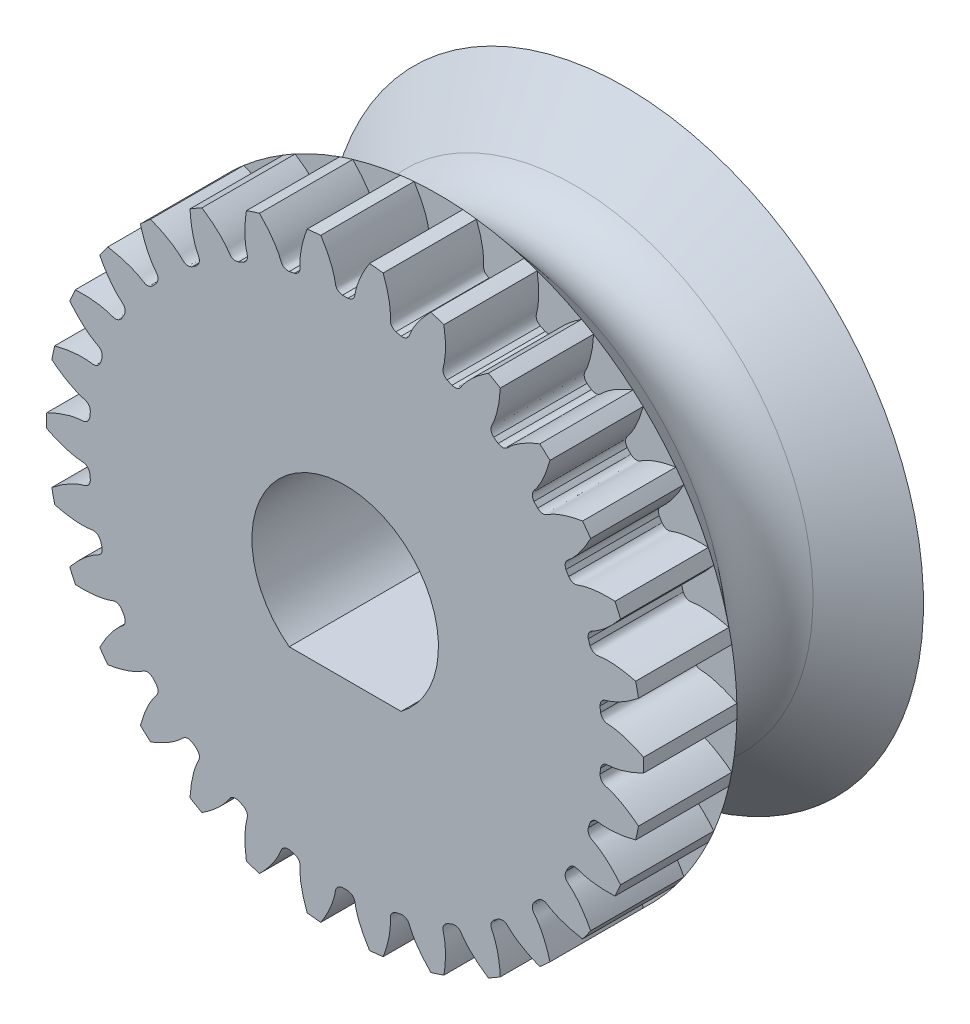
from build123d import *

# Parameters (mm, degrees)
SKETCH_1_R                      = 16
EXTRUDE_1_DEPTH                 = 5
CUT_EXTRUDE_1_DEPTH             = 24.173260453
PATTERN_CIRCULAR_1_COUNT        = 30
FILLET_1_R                      = 3
CUT_EXTRUDE_2_DEPTH             = 28.147746746
SKETCH_6_R                      = 3
CUT_EXTRUDE_3_DEPTH             = 12
CUT_EXTRUDE_4_REACH             = 32.529
SKETCH_7_R                      = 1.6
CUT_EXTRUDE_4_DIRECTION_2_DEPTH = 31.528675209


with BuildPart() as part:
    # 草图1 → 凸台-拉伸1 (new body)
    with BuildSketch(Plane.XY):
        Circle(SKETCH_1_R)
    extrude(amount=EXTRUDE_1_DEPTH)

    # 草图2 → 切除-拉伸1 (cut, through all)
    with BuildSketch(Plane.XY):
        with BuildLine():
            ThreePointArc((0.145558629, 13.749229531), (0, 13.75), (-0.145558629, 13.749229531))
            add(Edge.make_bspline(
                [(-0.145558629, 13.749229531), (-0.50823069, 13.81297517), (-0.510304747, 14.047132636), (-0.55898482, 14.288579015), (-0.569950741, 14.338129238), (-0.583247086, 14.392924909), (-0.599067717, 14.452897992), (-0.617630624, 14.517964907), (-0.639143358, 14.588038514), (-0.663813512, 14.663024477), (-0.691845294, 14.742822461), (-0.723440342, 14.827325855), (-0.758797267, 14.91642195), (-0.798111576, 15.009991983), (-0.841575482, 15.107911227), (-0.889377751, 15.210049075), (-0.941703547, 15.316269128), (-0.99873427, 15.426429286), (-1.060647407, 15.54038185), (-1.127616379, 15.657973616), (-1.199810393, 15.779045984), (-1.277394296, 15.903435064), (-1.36052843, 16.030971789), (-1.449368495, 16.161482028), (-1.544065407, 16.294786707), (-1.644765164, 16.430701934), (-1.751608718, 16.569039116), (-1.864731839, 16.709605098), (-1.984264996, 16.85220229), (-2.110333232, 16.996628804), (-2.243056043, 17.14267859), (-2.382547265, 17.290141584), (-2.528914958, 17.438803847), (-2.682261311, 17.588447714), (-2.842682483, 17.738851945), (-3.068923866, 17.942620828), (-3.245344618, 18.092071531), (-3.366311832, 18.190558123)],
                knots=[0, 0, 0, 0, 0.115323882, 0.12341257, 0.132512303, 0.142623081, 0.153744905, 0.165877774, 0.179021689, 0.193176649, 0.208342655, 0.224519706, 0.241707802, 0.259906945, 0.279117132, 0.299338365, 0.320570644, 0.342813968, 0.366068337, 0.390333752, 0.415610213, 0.441897719, 0.46919627, 0.497505867, 0.52682651, 0.557158198, 0.588500931, 0.62085471, 0.654219534, 0.688595404, 0.723982319, 0.76038028, 0.797789286, 0.836209338, 0.875640435, 0.916082578, 1, 1, 1, 1], degree=3))
            ThreePointArc((-3.366311832, 18.190558123), (0, 18.499417833), (3.366311832, 18.190558123))
            add(Edge.make_bspline(
                [(0.145558629, 13.749229531), (0.50823069, 13.81297517), (0.510304747, 14.047132636), (0.55898482, 14.288579015), (0.569950741, 14.338129238), (0.583247086, 14.392924909), (0.599067717, 14.452897992), (0.617630624, 14.517964907), (0.639143358, 14.588038514), (0.663813512, 14.663024477), (0.691845294, 14.742822461), (0.723440342, 14.827325855), (0.758797267, 14.91642195), (0.798111576, 15.009991983), (0.841575482, 15.107911227), (0.889377751, 15.210049075), (0.941703547, 15.316269128), (0.99873427, 15.426429286), (1.060647407, 15.54038185), (1.127616379, 15.657973616), (1.199810393, 15.779045984), (1.277394296, 15.903435064), (1.36052843, 16.030971789), (1.449368495, 16.161482028), (1.544065407, 16.294786707), (1.644765164, 16.430701934), (1.751608718, 16.569039116), (1.864731839, 16.709605098), (1.984264996, 16.85220229), (2.110333232, 16.996628804), (2.243056043, 17.14267859), (2.382547265, 17.290141584), (2.528914958, 17.438803847), (2.682261311, 17.588447714), (2.842682483, 17.738851945), (3.068923866, 17.942620828), (3.245344618, 18.092071531), (3.366311832, 18.190558123)],
                knots=[0, 0, 0, 0, 0.115323882, 0.12341257, 0.132512303, 0.142623081, 0.153744905, 0.165877774, 0.179021689, 0.193176649, 0.208342655, 0.224519706, 0.241707802, 0.259906945, 0.279117132, 0.299338365, 0.320570644, 0.342813968, 0.366068337, 0.390333752, 0.415610213, 0.441897719, 0.46919627, 0.497505867, 0.52682651, 0.557158198, 0.588500931, 0.62085471, 0.654219534, 0.688595404, 0.723982319, 0.76038028, 0.797789286, 0.836209338, 0.875640435, 0.916082578, 1, 1, 1, 1], degree=3))
        make_face()
    cut_extrude_1 = extrude(amount=CUT_EXTRUDE_1_DEPTH, mode=Mode.SUBTRACT)

    # 阵列(圆周)1: 切除-拉伸1 ×30 about axis
    pattern_circular_1_axis = Axis((0, 0, -1.5), (0, 0, 1))
    for i in range(1, PATTERN_CIRCULAR_1_COUNT):
        add(cut_extrude_1.rotate(pattern_circular_1_axis, i * 360 / PATTERN_CIRCULAR_1_COUNT), mode=Mode.SUBTRACT)

    # 草图4 → 旋转1 (revolve)
    with BuildSketch(Plane(origin=(0, 0, 0), x_dir=(1, 0, 0), z_dir=(0, 1, 0)), mode=Mode.PRIVATE) as revolve_1_sk:
        Polygon((0, 0), (16, 0), (10.041232037, 5), (16, 10), (0, 10), align=None)
    revolve(revolve_1_sk.sketch.rotate(Axis((0, 0, -8.630829696), (0, 0, 1)), 358.681060948), axis=Axis((0, 0, -8.630829696), (0, 0, 1)))

    # 圆角1
    fillet_1_edges = [part.edges().sort_by_distance(p)[0] for p in [
        (-10.038571667, 0.231127031, -5),
    ]]
    fillet(fillet_1_edges, radius=FILLET_1_R)

    # 草图5 → 切除-拉伸2 (cut, through all)
    with BuildSketch(Plane(origin=(0, 0, -10), x_dir=(-1, 0, 0), z_dir=(0, 0, -1))):
        with BuildLine():
            Line((-3, -4), (3, -4))
            ThreePointArc((3, -4), (0, 5), (-3, -4))
        make_face()
    extrude(amount=-CUT_EXTRUDE_2_DEPTH, mode=Mode.SUBTRACT)

    # 草图6 → 切除-拉伸3 (cut)
    with BuildSketch(Plane(origin=(0, -20, 0), x_dir=(1, 0, 0), z_dir=(0, 1, 0))):
        with Locations(Location((0, 5, 0), (0, 0, 129.999943096))):
            Circle(SKETCH_6_R)
    extrude(amount=CUT_EXTRUDE_3_DEPTH, mode=Mode.SUBTRACT)

    # 草图7 → 切除-拉伸4 (cut, up to next)
    with BuildSketch(Plane.XZ.offset(8), mode=Mode.PRIVATE) as cut_extrude_4_sk1:
        with Locations(Location((0, -5, 0), (0, 0, 90))):
            Circle(SKETCH_7_R)
    cut_extrude_4_tool1 = extrude(cut_extrude_4_sk1.sketch, amount=-CUT_EXTRUDE_4_REACH, mode=Mode.PRIVATE) & part.part
    add(cut_extrude_4_tool1.solids().sort_by_distance((0, -8, -5))[0], mode=Mode.SUBTRACT)

    # 草图7 → 切除-拉伸4 direction 2 (cut)
    with BuildSketch(Plane.XZ.offset(8)):
        with Locations(Location((0, -5, 0), (0, 0, 90))):
            Circle(SKETCH_7_R)
    extrude(amount=CUT_EXTRUDE_4_DIRECTION_2_DEPTH, mode=Mode.SUBTRACT)


solid = part.part
